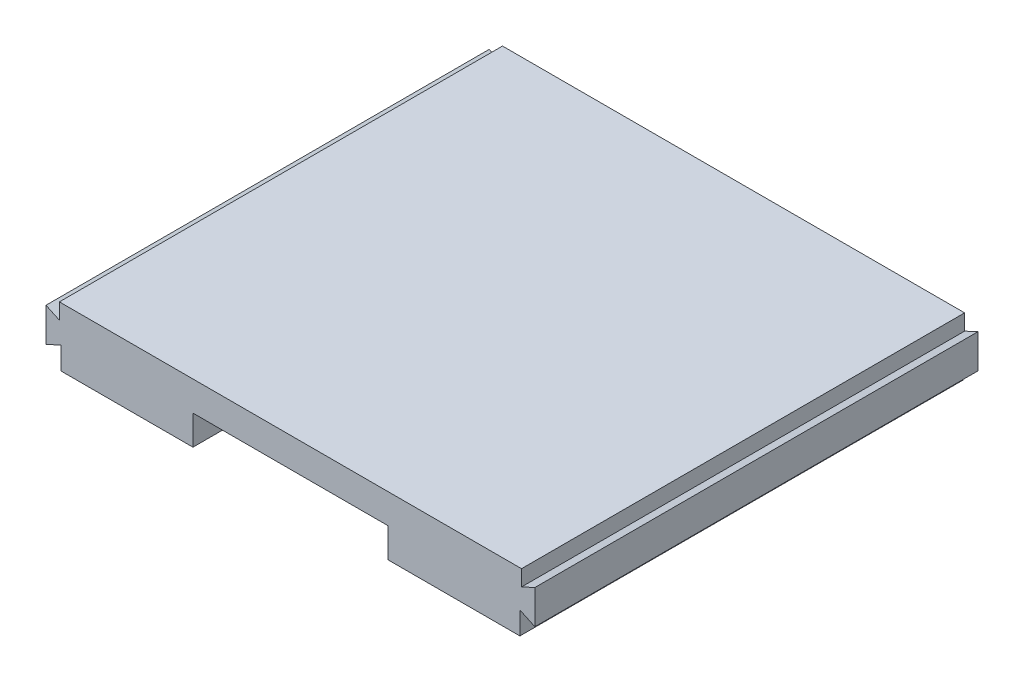
from build123d import *

# Parameters (mm, degrees)
SKETCH1_W             = 3
SKETCH1_H             = 49
BOSS_EXTRUDE1_DEPTH   = 10
BOSS_EXTRUDE1_2_DEPTH = 10
BOSS_EXTRUDE2_START   = -10
SKETCH2_W             = 33.1
SKETCH2_H             = 30
BOSS_EXTRUDE2_DEPTH   = 4
CUT_EXTRUDE1_START    = -10
SKETCH3_W             = 13.2
SKETCH3_H             = 30
CUT_EXTRUDE1_DEPTH    = 2
CUT_EXTRUDE2_START    = -3
CUT_EXTRUDE2_DEPTH    = 2.5
CUT_EXTRUDE3_START    = -36.1
SKETCH6_R             = 1.6
CUT_EXTRUDE3_DEPTH    = 2.5
CUT_EXTRUDE4_START    = -3.4
CUT_EXTRUDE4_DEPTH    = 3.2
CUT_EXTRUDE6_DEPTH    = 54.695460702


with BuildPart() as part:
    # Sketch1 → Boss-Extrude1 (new body)
    with BuildSketch(Plane(origin=(0, 0, 0), x_dir=(1, 0, 0), z_dir=(0, 1, 0))):
        with Locations((-18.05, 24.5)):
            Rectangle(SKETCH1_W, SKETCH1_H)
    extrude(amount=BOSS_EXTRUDE1_DEPTH)



with BuildPart() as body_2:
    # Sketch1 → Boss-Extrude1 2 (new body)
    with BuildSketch(Plane(origin=(0, 0, 0), x_dir=(1, 0, 0), z_dir=(0, 1, 0))):
        with Locations((18.05, 24.5)):
            Rectangle(SKETCH1_W, SKETCH1_H)
    extrude(amount=BOSS_EXTRUDE1_2_DEPTH)


with BuildPart() as part_1:
    add(part.part)

    add(body_2.part)  # Boss-Extrude2 merges body 2
    # Sketch2 → Boss-Extrude2 (add)
    with BuildSketch(Plane(origin=(0, 10, 0), x_dir=(1, 0, 0), z_dir=(0, 1, 0)).offset(BOSS_EXTRUDE2_START)):
        with Locations((0, 34)):
            Rectangle(SKETCH2_W, SKETCH2_H)
    extrude(amount=BOSS_EXTRUDE2_DEPTH)

    # Sketch3 → Cut-Extrude1 (cut)
    with BuildSketch(Plane(origin=(0, 10, 0), x_dir=(1, 0, 0), z_dir=(0, 1, 0)).offset(CUT_EXTRUDE1_START)):
        with Locations((0, 34)):
            Rectangle(SKETCH3_W, SKETCH3_H)
    extrude(amount=CUT_EXTRUDE1_DEPTH, mode=Mode.SUBTRACT)

    # Sketch5 → Cut-Extrude2 (cut)
    with BuildSketch(Plane.ZY.offset(19.55).offset(CUT_EXTRUDE2_START)):
        with BuildLine():
            Line((-4.75, 7.236067977), (-4.854831539, 6.824677172))
            ThreePointArc((-4.854831539, 6.824677172), (-4.891407754, 6.769616655), (-4.954343768, 6.74940433))
            ThreePointArc((-4.954343768, 6.74940433), (-5, 6.75), (-5.045656232, 6.74940433))
            ThreePointArc((-5.045656232, 6.74940433), (-5.108592246, 6.769616655), (-5.145168461, 6.824677172))
            Line((-5.145168461, 6.824677172), (-5.25, 7.236067977))
            ThreePointArc((-5.25, 7.236067977), (-5.3907084, 7.215817444), (-5.529857135, 7.186721614))
            Line((-5.529857135, 7.186721614), (-5.487662617, 6.764286212))
            ThreePointArc((-5.487662617, 6.764286212), (-5.503201209, 6.700036448), (-5.555428696, 6.65951769))
            ThreePointArc((-5.555428696, 6.65951769), (-5.598535251, 6.644462086), (-5.641234343, 6.628286988))
            ThreePointArc((-5.641234343, 6.628286988), (-5.707287874, 6.625754976), (-5.760490079, 6.664985136))
            Line((-5.760490079, 6.664985136), (-5.999703445, 7.015711542))
            ThreePointArc((-5.999703445, 7.015711542), (-6.125, 6.948557159), (-6.24580568, 6.873624351))
            Line((-6.24580568, 6.873624351), (-6.061674385, 6.491096296))
            ThreePointArc((-6.061674385, 6.491096296), (-6.054301173, 6.425406755), (-6.089520725, 6.369468725))
            ThreePointArc((-6.089520725, 6.369468725), (-6.124878317, 6.340577775), (-6.15947013, 6.310774205))
            ThreePointArc((-6.15947013, 6.310774205), (-6.220674146, 6.285803254), (-6.28408537, 6.30447132))
            Line((-6.28408537, 6.30447132), (-6.628827901, 6.552230546))
            ThreePointArc((-6.628827901, 6.552230546), (-6.723599997, 6.446272122), (-6.811491673, 6.33454034))
            Line((-6.811491673, 6.33454034), (-6.507632554, 6.038058161))
            ThreePointArc((-6.507632554, 6.038058161), (-6.478236855, 5.978851971), (-6.492200475, 5.914241621))
            ThreePointArc((-6.492200475, 5.914241621), (-6.515544457, 5.875), (-6.537856707, 5.835162708))
            ThreePointArc((-6.537856707, 5.835162708), (-6.586829101, 5.790764683), (-6.652801015, 5.786619011))
            Line((-6.652801015, 5.786619011), (-7.061491673, 5.901527638))
            ThreePointArc((-7.061491673, 5.901527638), (-7.114308397, 5.769545322), (-7.158685036, 5.634491068))
            Line((-7.158685036, 5.634491068), (-6.771747987, 5.459814891))
            ThreePointArc((-6.771747987, 5.459814891), (-6.723875356, 5.414233193), (-6.714898826, 5.348743485))
            ThreePointArc((-6.714898826, 5.348743485), (-6.723413568, 5.303884311), (-6.730755068, 5.258818263))
            ThreePointArc((-6.730755068, 5.258818263), (-6.761589047, 5.200348221), (-6.822164464, 5.17388884))
            Line((-6.822164464, 5.17388884), (-7.245509125, 5.142087191))
            ThreePointArc((-7.245509125, 5.142087191), (-7.25, 5), (-7.245509125, 4.857912809))
            Line((-7.245509125, 4.857912809), (-6.822164464, 4.82611116))
            ThreePointArc((-6.822164464, 4.82611116), (-6.761589047, 4.799651779), (-6.730755068, 4.741181737))
            ThreePointArc((-6.730755068, 4.741181737), (-6.723413568, 4.696115689), (-6.714898826, 4.651256515))
            ThreePointArc((-6.714898826, 4.651256515), (-6.723875356, 4.585766807), (-6.771747987, 4.540185109))
            Line((-6.771747987, 4.540185109), (-7.158685036, 4.365508932))
            ThreePointArc((-7.158685036, 4.365508932), (-7.114308397, 4.230454678), (-7.061491673, 4.098472362))
            Line((-7.061491673, 4.098472362), (-6.652801015, 4.213380989))
            ThreePointArc((-6.652801015, 4.213380989), (-6.586829101, 4.209235317), (-6.537856707, 4.164837292))
            ThreePointArc((-6.537856707, 4.164837292), (-6.515544457, 4.125), (-6.492200475, 4.085758379))
            ThreePointArc((-6.492200475, 4.085758379), (-6.478236855, 4.021148029), (-6.507632554, 3.961941839))
            Line((-6.507632554, 3.961941839), (-6.811491673, 3.66545966))
            ThreePointArc((-6.811491673, 3.66545966), (-6.723599997, 3.553727878), (-6.628827901, 3.447769454))
            Line((-6.628827901, 3.447769454), (-6.28408537, 3.69552868))
            ThreePointArc((-6.28408537, 3.69552868), (-6.220674146, 3.714196746), (-6.15947013, 3.689225795))
            ThreePointArc((-6.15947013, 3.689225795), (-6.124878317, 3.659422225), (-6.089520725, 3.630531275))
            ThreePointArc((-6.089520725, 3.630531275), (-6.054301173, 3.574593245), (-6.061674385, 3.508903704))
            Line((-6.061674385, 3.508903704), (-6.24580568, 3.126375649))
            ThreePointArc((-6.24580568, 3.126375649), (-6.125, 3.051442841), (-5.999703445, 2.984288458))
            Line((-5.999703445, 2.984288458), (-5.760490079, 3.335014864))
            ThreePointArc((-5.760490079, 3.335014864), (-5.707287874, 3.374245024), (-5.641234343, 3.371713012))
            ThreePointArc((-5.641234343, 3.371713012), (-5.598535251, 3.355537914), (-5.555428696, 3.34048231))
            ThreePointArc((-5.555428696, 3.34048231), (-5.503201209, 3.299963552), (-5.487662617, 3.235713788))
            Line((-5.487662617, 3.235713788), (-5.529857135, 2.813278386))
            ThreePointArc((-5.529857135, 2.813278386), (-5.3907084, 2.784182556), (-5.25, 2.763932023))
            Line((-5.25, 2.763932023), (-5.145168461, 3.175322828))
            ThreePointArc((-5.145168461, 3.175322828), (-5.108592246, 3.230383345), (-5.045656232, 3.25059567))
            ThreePointArc((-5.045656232, 3.25059567), (-5, 3.25), (-4.954343768, 3.25059567))
            ThreePointArc((-4.954343768, 3.25059567), (-4.891407754, 3.230383345), (-4.854831539, 3.175322828))
            Line((-4.854831539, 3.175322828), (-4.75, 2.763932023))
            ThreePointArc((-4.75, 2.763932023), (-4.6092916, 2.784182556), (-4.470142865, 2.813278386))
            Line((-4.470142865, 2.813278386), (-4.512337383, 3.235713788))
            ThreePointArc((-4.512337383, 3.235713788), (-4.496798791, 3.299963552), (-4.444571304, 3.34048231))
            ThreePointArc((-4.444571304, 3.34048231), (-4.401464749, 3.355537914), (-4.358765657, 3.371713012))
            ThreePointArc((-4.358765657, 3.371713012), (-4.292712126, 3.374245024), (-4.239509921, 3.335014864))
            Line((-4.239509921, 3.335014864), (-4.000296555, 2.984288458))
            ThreePointArc((-4.000296555, 2.984288458), (-3.875, 3.051442841), (-3.75419432, 3.126375649))
            Line((-3.75419432, 3.126375649), (-3.938325615, 3.508903704))
            ThreePointArc((-3.938325615, 3.508903704), (-3.945698827, 3.574593245), (-3.910479275, 3.630531275))
            ThreePointArc((-3.910479275, 3.630531275), (-3.875121683, 3.659422225), (-3.84052987, 3.689225795))
            ThreePointArc((-3.84052987, 3.689225795), (-3.779325854, 3.714196746), (-3.71591463, 3.69552868))
            Line((-3.71591463, 3.69552868), (-3.371172099, 3.447769454))
            ThreePointArc((-3.371172099, 3.447769454), (-3.276400003, 3.553727878), (-3.188508327, 3.66545966))
            Line((-3.188508327, 3.66545966), (-3.492367446, 3.961941839))
            ThreePointArc((-3.492367446, 3.961941839), (-3.521763145, 4.021148029), (-3.507799525, 4.085758379))
            ThreePointArc((-3.507799525, 4.085758379), (-3.484455543, 4.125), (-3.462143293, 4.164837292))
            ThreePointArc((-3.462143293, 4.164837292), (-3.413170899, 4.209235317), (-3.347198985, 4.213380989))
            Line((-3.347198985, 4.213380989), (-2.938508327, 4.098472362))
            ThreePointArc((-2.938508327, 4.098472362), (-2.885691603, 4.230454678), (-2.841314964, 4.365508932))
            Line((-2.841314964, 4.365508932), (-3.228252013, 4.540185109))
            ThreePointArc((-3.228252013, 4.540185109), (-3.276124644, 4.585766807), (-3.285101174, 4.651256515))
            ThreePointArc((-3.285101174, 4.651256515), (-3.276586432, 4.696115689), (-3.269244932, 4.741181737))
            ThreePointArc((-3.269244932, 4.741181737), (-3.238410953, 4.799651779), (-3.177835536, 4.82611116))
            Line((-3.177835536, 4.82611116), (-2.754490875, 4.857912809))
            ThreePointArc((-2.754490875, 4.857912809), (-2.75, 5), (-2.754490875, 5.142087191))
            Line((-2.754490875, 5.142087191), (-3.177835536, 5.17388884))
            ThreePointArc((-3.177835536, 5.17388884), (-3.238410953, 5.200348221), (-3.269244932, 5.258818263))
            ThreePointArc((-3.269244932, 5.258818263), (-3.276586432, 5.303884311), (-3.285101174, 5.348743485))
            ThreePointArc((-3.285101174, 5.348743485), (-3.276124644, 5.414233193), (-3.228252013, 5.459814891))
            Line((-3.228252013, 5.459814891), (-2.841314964, 5.634491068))
            ThreePointArc((-2.841314964, 5.634491068), (-2.885691603, 5.769545322), (-2.938508327, 5.901527638))
            Line((-2.938508327, 5.901527638), (-3.347198985, 5.786619011))
            ThreePointArc((-3.347198985, 5.786619011), (-3.413170899, 5.790764683), (-3.462143293, 5.835162708))
            ThreePointArc((-3.462143293, 5.835162708), (-3.484455543, 5.875), (-3.507799525, 5.914241621))
            ThreePointArc((-3.507799525, 5.914241621), (-3.521763145, 5.978851971), (-3.492367446, 6.038058161))
            Line((-3.492367446, 6.038058161), (-3.188508327, 6.33454034))
            ThreePointArc((-3.188508327, 6.33454034), (-3.276400003, 6.446272122), (-3.371172099, 6.552230546))
            Line((-3.371172099, 6.552230546), (-3.71591463, 6.30447132))
            ThreePointArc((-3.71591463, 6.30447132), (-3.779325854, 6.285803254), (-3.84052987, 6.310774205))
            ThreePointArc((-3.84052987, 6.310774205), (-3.875121683, 6.340577775), (-3.910479275, 6.369468725))
            ThreePointArc((-3.910479275, 6.369468725), (-3.945698827, 6.425406755), (-3.938325615, 6.491096296))
            Line((-3.938325615, 6.491096296), (-3.75419432, 6.873624351))
            ThreePointArc((-3.75419432, 6.873624351), (-3.875, 6.948557159), (-4.000296555, 7.015711542))
            Line((-4.000296555, 7.015711542), (-4.239509921, 6.664985136))
            ThreePointArc((-4.239509921, 6.664985136), (-4.292712126, 6.625754976), (-4.358765657, 6.628286988))
            ThreePointArc((-4.358765657, 6.628286988), (-4.401464749, 6.644462086), (-4.444571304, 6.65951769))
            ThreePointArc((-4.444571304, 6.65951769), (-4.496798791, 6.700036448), (-4.512337383, 6.764286212))
            Line((-4.512337383, 6.764286212), (-4.470142865, 7.186721614))
            ThreePointArc((-4.470142865, 7.186721614), (-4.6092916, 7.215817444), (-4.75, 7.236067977))
        make_face()
    extrude(amount=CUT_EXTRUDE2_DEPTH, mode=Mode.SUBTRACT)

    # Sketch6 → Cut-Extrude3 (cut)
    with BuildSketch(Plane.ZY.offset(19.55).offset(CUT_EXTRUDE3_START)):
        with Locations(Location((-5, 5, 0), (0, 0, 180))):
            Circle(SKETCH6_R)
    extrude(amount=-CUT_EXTRUDE3_DEPTH, mode=Mode.SUBTRACT)

    # Sketch9 → Cut-Extrude4 (cut)
    with BuildSketch(Plane(origin=(0, 10, 0), x_dir=(1, 0, 0), z_dir=(0, 1, 0)).offset(CUT_EXTRUDE4_START)):
        Polygon((16.55, 5), (17.55, 5), (19.05, 0), (16.55, 0), align=None)
    extrude(amount=-CUT_EXTRUDE4_DEPTH, mode=Mode.SUBTRACT)

    # Sketch10 → Cut-Extrude6 (cut, through all)
    with BuildSketch(Plane(origin=(0, 0, -49), x_dir=(-1, 0, 0), z_dir=(0, 0, -1))):
        Polygon((-15.644123368, 2.927582789), (-16.55, 3.35), (-16.55, 1.05), (-15.534888499, 1.523354267), (-15.534888499, -2.347783868), (-19.962773438, -2.347783868), (-19.962773438, 10.874284902), (-15.644123368, 10.874284902), align=None)
        Polygon((19.962773438, 10.874284902), (15.644123368, 10.874284902), (15.644123368, 2.927582789), (16.55, 3.35), (16.55, 1.05), (15.534888499, 1.523354267), (15.534888499, -2.347783868), (19.962773438, -2.347783868), align=None)
    extrude(amount=-CUT_EXTRUDE6_DEPTH, mode=Mode.SUBTRACT)


solid = part_1.part
